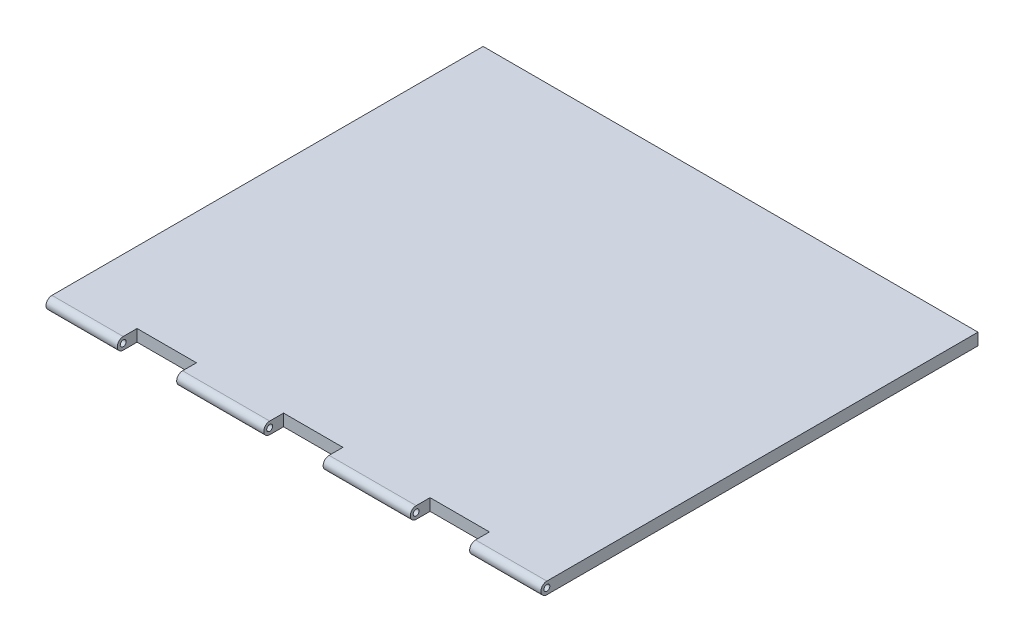
from build123d import *

# Parameters (mm, degrees)
SKETCH_1_W          = 250
SKETCH_1_H          = 220.8
EXTRUDE_1_DEPTH     = 3
CUT_EXTRUDE_1_REACH = 223.019
SKETCH_2_W          = 30
SKETCH_2_H          = 10
SKETCH_3_R          = 1.5
CUT_EXTRUDE_2_DEPTH = 295.913282021


with BuildPart() as part:
    # 草图1 → 凸台-拉伸1 (new, symmetric)
    with BuildSketch(Plane(origin=(0, 0, 0), x_dir=(1, 0, 0), z_dir=(0, 1, 0))):
        with Locations((31.040268456, -46.012416107)):
            Rectangle(SKETCH_1_W, SKETCH_1_H)
    extrude(amount=EXTRUDE_1_DEPTH, both=True)

    # 草图2 → 切除-拉伸1 (cut, up to next)
    with BuildSketch(Plane(origin=(0, 3, 0), x_dir=(1, 0, 0), z_dir=(0, 1, 0)), mode=Mode.PRIVATE) as cut_extrude_1_sk1:
        with Locations((-42.959731544, -151.412416107)):
            Rectangle(SKETCH_2_W, SKETCH_2_H)
    cut_extrude_1_tool1 = extrude(cut_extrude_1_sk1.sketch, amount=-CUT_EXTRUDE_1_REACH, mode=Mode.PRIVATE) & part.part
    # 草图2 → 切除-拉伸1 (cut, up to next)
    with BuildSketch(Plane(origin=(0, 3, 0), x_dir=(1, 0, 0), z_dir=(0, 1, 0)), mode=Mode.PRIVATE) as cut_extrude_1_sk2:
        with Locations((31.040268456, -151.412416107)):
            Rectangle(SKETCH_2_W, SKETCH_2_H)
    cut_extrude_1_tool2 = extrude(cut_extrude_1_sk2.sketch, amount=-CUT_EXTRUDE_1_REACH, mode=Mode.PRIVATE) & part.part
    # 草图2 → 切除-拉伸1 (cut, up to next)
    with BuildSketch(Plane(origin=(0, 3, 0), x_dir=(1, 0, 0), z_dir=(0, 1, 0)), mode=Mode.PRIVATE) as cut_extrude_1_sk3:
        with Locations((105.040268456, -151.412416107)):
            Rectangle(SKETCH_2_W, SKETCH_2_H)
    cut_extrude_1_tool3 = extrude(cut_extrude_1_sk3.sketch, amount=-CUT_EXTRUDE_1_REACH, mode=Mode.PRIVATE) & part.part
    add(cut_extrude_1_tool1.solids().sort_by_distance((-42.959732, 3, 151.412416))[0], mode=Mode.SUBTRACT)
    add(cut_extrude_1_tool2.solids().sort_by_distance((31.040268, 3, 151.412416))[0], mode=Mode.SUBTRACT)
    add(cut_extrude_1_tool3.solids().sort_by_distance((105.040268, 3, 151.412416))[0], mode=Mode.SUBTRACT)

    # 草图3 → 切除-拉伸2 (cut, through all)
    with BuildSketch(Plane.ZY.offset(93.959731544)):
        with Locations((153.412416107, 0)):
            Circle(SKETCH_3_R)
        with BuildLine():
            Line((156.412416107, 3), (153.412416107, 3))
            ThreePointArc((153.412416107, 3), (155.533736451, 2.121320344), (156.412416107, 0))
            Line((156.412416107, 0), (156.412416107, 3))
        make_face()
        with BuildLine():
            Line((156.412416107, -3), (156.412416107, 0))
            ThreePointArc((156.412416107, 0), (155.533736451, -2.121320344), (153.412416107, -3))
            Line((153.412416107, -3), (156.412416107, -3))
        make_face()
    extrude(amount=-CUT_EXTRUDE_2_DEPTH, mode=Mode.SUBTRACT)


solid = part.part
